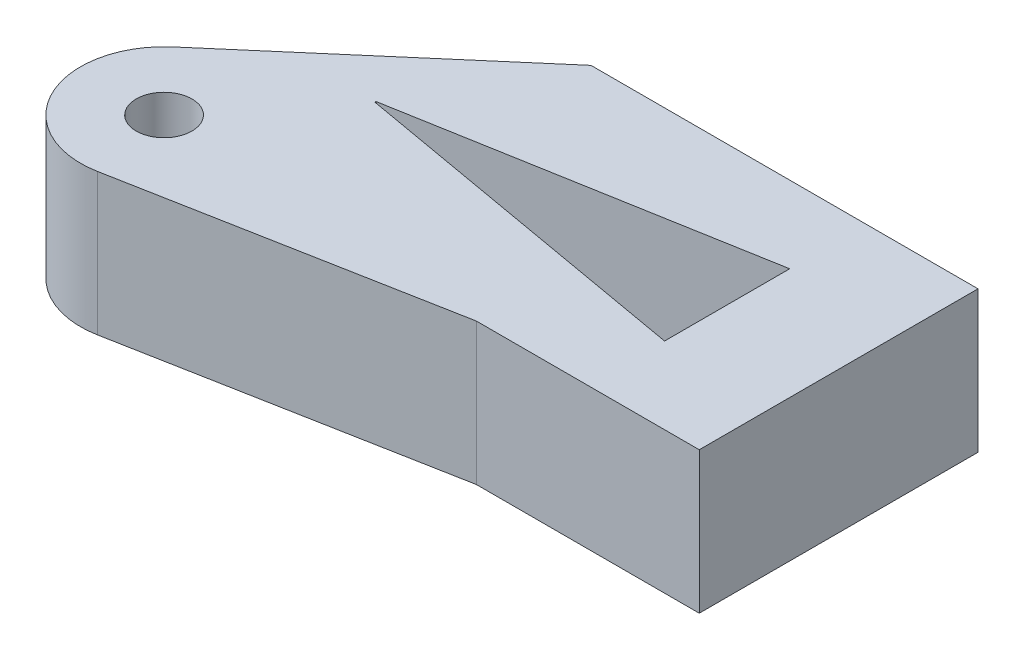
from build123d import *

# Parameters (mm, degrees)
SKETCH2_R           = 2.5
BOSS_EXTRUDE1_DEPTH = 6.35


with BuildPart() as part:
    # Sketch2 → Boss-Extrude1 (new, symmetric)
    with BuildSketch(Plane(origin=(0, 0, 0), x_dir=(1, 0, 0), z_dir=(0, 1, 0))):
        with BuildLine():
            Line((-34.883854573, -4.808079014), (-14.712038095, 12.5))
            Line((-14.712038095, 12.5), (20, 12.5))
            Line((20, 12.5), (20, -12.5))
            Line((20, -12.5), (0, -12.5))
            Line((0, -12.5), (-28.616418364, -17.871275457))
            ThreePointArc((-28.616418364, -17.871275457), (-36.762008058, -13.74426371), (-34.883854573, -4.808079014))
        make_face()
        with Locations(Location((-30, -10.5, 0), (0, 0, 270))):
            Circle(SKETCH2_R, mode=Mode.SUBTRACT)
        Polygon((-21.542043285, 0.051346502), (-21.542043285, -0.051346502), (10, -5.61305976), (10, 5.61305976), align=None, mode=Mode.SUBTRACT)
    extrude(amount=BOSS_EXTRUDE1_DEPTH, both=True)


solid = part.part
